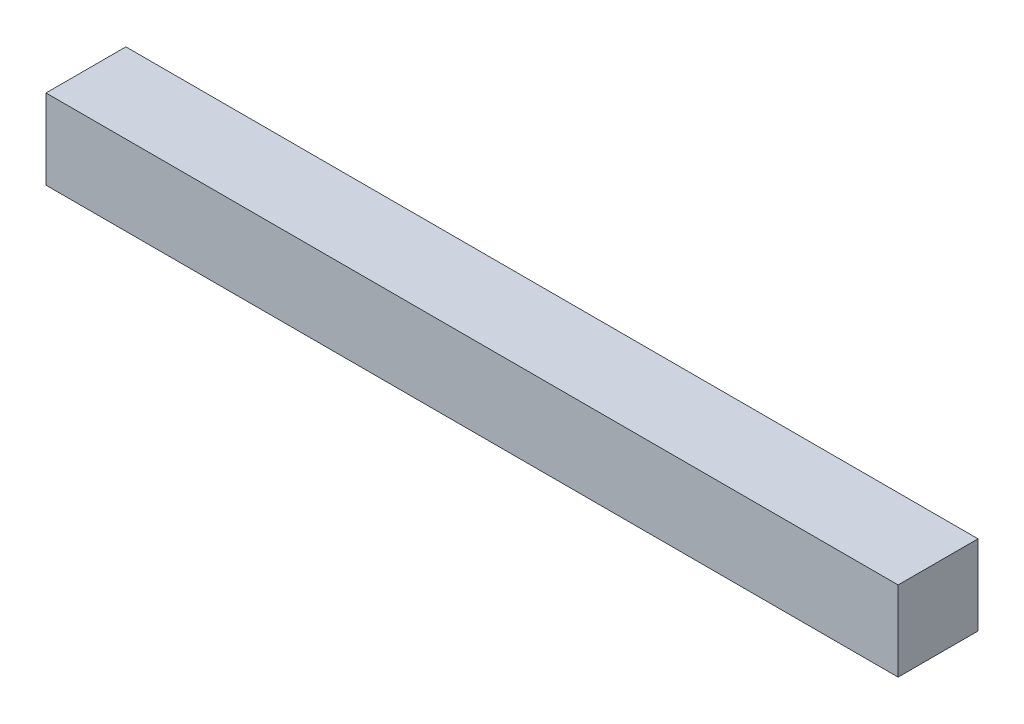
from build123d import *

# Parameters (mm, degrees)
SKETCH1_W           = 406.4
SKETCH1_H           = 38.1
BOSS_EXTRUDE1_DEPTH = 38.1


with BuildPart() as part:
    # Sketch1 → Boss-Extrude1 (new body)
    with BuildSketch(Plane.XY):
        Rectangle(SKETCH1_W, SKETCH1_H)
    extrude(amount=BOSS_EXTRUDE1_DEPTH)


solid = part.part
